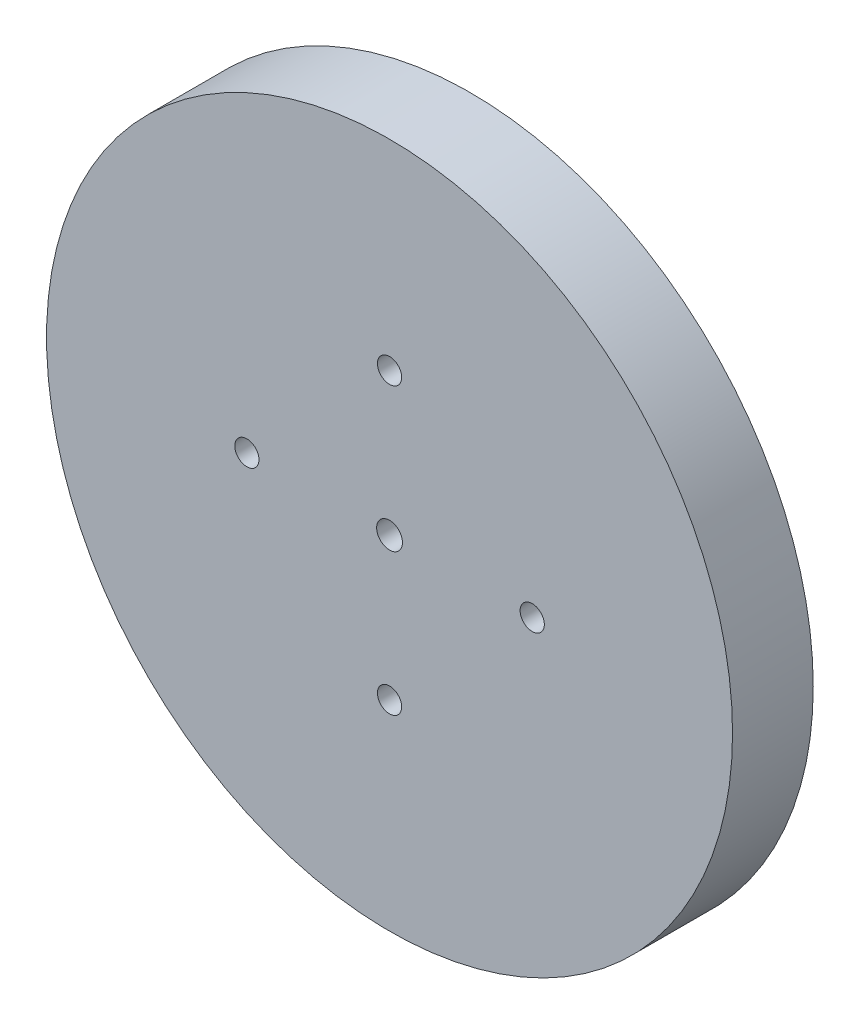
from build123d import *

# Parameters (mm, degrees)
SKETCH_1_R          = 42.5
EXTRUDE_1_DEPTH     = 10
SKETCH_2_R          = 39.5
CUT_EXTRUDE_1_DEPTH = 7
SKETCH_4_R          = 1.5
SKETCH_4_R_2        = 1.6
CUT_EXTRUDE_2_DEPTH = 61.930288035


with BuildPart() as part:
    # 草图1 → 凸台-拉伸1 (new body)
    with BuildSketch(Plane.XY):
        Circle(SKETCH_1_R)
    extrude(amount=EXTRUDE_1_DEPTH)

    # 草图2 → 切除-拉伸1 (cut)
    with BuildSketch(Plane(origin=(0, 0, 0), x_dir=(-1, 0, 0), z_dir=(0, 0, -1))):
        Circle(SKETCH_2_R)
    extrude(amount=-CUT_EXTRUDE_1_DEPTH, mode=Mode.SUBTRACT)

    # 草图4 → 切除-拉伸2 (cut, through all)
    with BuildSketch(Plane.XY.offset(10)):
        with Locations((0, 17.67766953)):
            Circle(SKETCH_4_R)
        with Locations((17.67766953, 0)):
            Circle(SKETCH_4_R)
        with Locations((0, -17.67766953)):
            Circle(SKETCH_4_R)
        with Locations((-17.67766953, 0)):
            Circle(SKETCH_4_R)
        Circle(SKETCH_4_R_2)
    extrude(amount=-CUT_EXTRUDE_2_DEPTH, mode=Mode.SUBTRACT)

    # 草图5 → 切除-旋转1 (revolve, cut)
    with BuildSketch(Plane(origin=(0, 0, 0), x_dir=(1, 0, 0), z_dir=(0, 1, 0)), mode=Mode.PRIVATE) as cut_revolve_1_sk:
        with BuildLine():
            Line((40.272743429, 0), (41.727256571, 0))
            ThreePointArc((41.727256571, 0), (41, -0.466686515), (40.272743429, 0))
        make_face()
    revolve(cut_revolve_1_sk.sketch.rotate(Axis((0, 0, -35.110243207), (0, 0, 1)), 180), axis=Axis((0, 0, -35.110243207), (0, 0, 1)), mode=Mode.SUBTRACT)


solid = part.part
